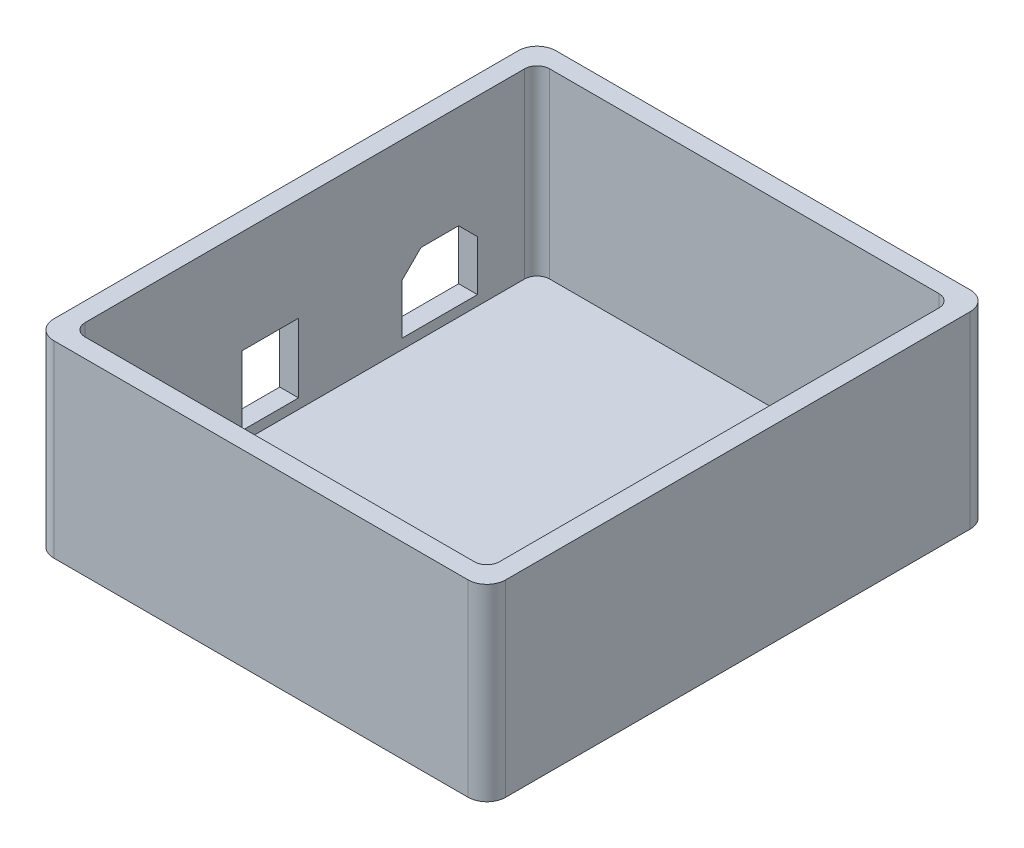
from build123d import *

# Parameters (mm, degrees)
BOSS_EXTRUDE1_DEPTH = 30
CUT_EXTRUDE1_DEPTH  = 29
CUT_EXTRUDE3_DEPTH  = 10
SKETCH6_W           = 27.115913197
SKETCH6_H           = 16.602687323
BOSS_EXTRUDE2_DEPTH = 3
SKETCH7_W           = 8.89
SKETCH7_H           = 10.922
CUT_EXTRUDE4_DEPTH  = 6350
BOSS_EXTRUDE3_START = -3
SKETCH8_W           = 8.89
SKETCH8_H           = 10.922
BOSS_EXTRUDE3_DEPTH = 3
BOSS_EXTRUDE4_START = -3
SKETCH9_W           = 8.89
SKETCH9_H           = 10.922
BOSS_EXTRUDE4_DEPTH = 3
SKETCH12_W          = 9
SKETCH12_H          = 11
CUT_EXTRUDE6_DEPTH  = 3


with BuildPart() as part:
    # Sketch2 → Boss-Extrude1 (new body)
    with BuildSketch(Plane(origin=(0, 0, 0), x_dir=(1, 0, 0), z_dir=(0, 1, 0))):
        with BuildLine():
            Line((-36.97733711, 28.555240793), (29.02266289, 28.555240793))
            ThreePointArc((29.02266289, 28.555240793), (31.143983233, 27.676561137), (32.02266289, 25.555240793))
            Line((32.02266289, 25.555240793), (32.02266289, -48.444759207))
            ThreePointArc((32.02266289, -48.444759207), (31.143983233, -50.56607955), (29.02266289, -51.444759207))
            Line((29.02266289, -51.444759207), (-36.97733711, -51.444759207))
            ThreePointArc((-36.97733711, -51.444759207), (-39.098657454, -50.56607955), (-39.97733711, -48.444759207))
            Line((-39.97733711, -48.444759207), (-39.97733711, 25.555240793))
            ThreePointArc((-39.97733711, 25.555240793), (-39.098657454, 27.676561137), (-36.97733711, 28.555240793))
        make_face()
    extrude(amount=BOSS_EXTRUDE1_DEPTH)

    # Sketch3 → Cut-Extrude1 (cut)
    with BuildSketch(Plane(origin=(0, 30, 0), x_dir=(1, 0, 0), z_dir=(0, 1, 0))):
        with BuildLine():
            Line((-34.97733711, 25.555240793), (27.02266289, 25.555240793))
            ThreePointArc((27.02266289, 25.555240793), (28.436876452, 24.969454356), (29.02266289, 23.555240793))
            Line((29.02266289, 23.555240793), (29.02266289, -46.444759207))
            ThreePointArc((29.02266289, -46.444759207), (28.436876452, -47.858972769), (27.02266289, -48.444759207))
            Line((27.02266289, -48.444759207), (-34.97733711, -48.444759207))
            ThreePointArc((-34.97733711, -48.444759207), (-36.391550673, -47.858972769), (-36.97733711, -46.444759207))
            Line((-36.97733711, -46.444759207), (-36.97733711, 23.555240793))
            ThreePointArc((-36.97733711, 23.555240793), (-36.391550673, 24.969454356), (-34.97733711, 25.555240793))
        make_face()
    extrude(amount=-CUT_EXTRUDE1_DEPTH, mode=Mode.SUBTRACT)

    # Sketch5 → Cut-Extrude3 (cut)
    with BuildSketch(Plane.ZY.offset(39.97733711)):
        Polygon((14.109885792, 14.391226726), (9.109885792, 14.391226726), (6.109885792, 11.394962385), (6.109885792, 2.391226726), (17.109885792, 2.391226726), (17.109885792, 11.394962385), align=None)
    extrude(amount=-CUT_EXTRUDE3_DEPTH, mode=Mode.SUBTRACT)

    # Sketch6 → Boss-Extrude2 (add)
    with BuildSketch(Plane.ZY.offset(39.97733711)):
        with Locations((11.822368645, 9.478185332)):
            Rectangle(SKETCH6_W, SKETCH6_H)
    extrude(amount=-BOSS_EXTRUDE2_DEPTH)

    # Sketch7 → Cut-Extrude4 (cut)
    with BuildSketch(Plane.XY.offset(51.444759207)):
        Polygon((-29.154490055, 10.403434977), (-26.106490055, 13.462), (-20.275055078, 13.462), (-17.216490055, 10.414), (-17.216490055, 2.54), (-29.154490055, 2.54), align=None)
        with Locations((19.417783934, 8.001)):
            Rectangle(SKETCH7_W, SKETCH7_H)
    extrude(amount=-CUT_EXTRUDE4_DEPTH, mode=Mode.SUBTRACT)

    # Sketch8 → Boss-Extrude3 (add)
    with BuildSketch(Plane(origin=(0, 0, -28.555240793), x_dir=(-1, 0, 0), z_dir=(0, 0, -1)).offset(BOSS_EXTRUDE3_START)):
        Polygon((26.106490055, 13.462), (20.275055078, 13.462), (17.216490055, 10.414), (17.216490055, 2.54), (29.154490055, 2.54), (29.154490055, 10.403434977), align=None)
        with Locations((-19.417783934, 8.001)):
            Rectangle(SKETCH8_W, SKETCH8_H)
    extrude(amount=BOSS_EXTRUDE3_DEPTH)

    # Sketch9 → Boss-Extrude4 (add)
    with BuildSketch(Plane.XY.offset(51.444759207).offset(BOSS_EXTRUDE4_START)):
        Polygon((-29.154490055, 2.54), (-17.216490055, 2.54), (-17.216490055, 10.414), (-20.275055078, 13.462), (-26.106490055, 13.462), (-29.154490055, 10.403434977), align=None)
        with Locations((19.417783934, 8.001)):
            Rectangle(SKETCH9_W, SKETCH9_H)
    extrude(amount=BOSS_EXTRUDE4_DEPTH)

    # Sketch12 → Cut-Extrude6 (cut)
    with BuildSketch(Plane.ZY.offset(39.97733711)):
        Polygon((-16.055240793, 10.6), (-16.055240793, 2.6), (-4.055240793, 2.6), (-4.055240793, 10.6), (-7.055240793, 13.596264341), (-13.055240793, 13.596264341), align=None)
        with Locations((16.944759207, 8.1)):
            Rectangle(SKETCH12_W, SKETCH12_H)
    extrude(amount=-CUT_EXTRUDE6_DEPTH, mode=Mode.SUBTRACT)


solid = part.part
